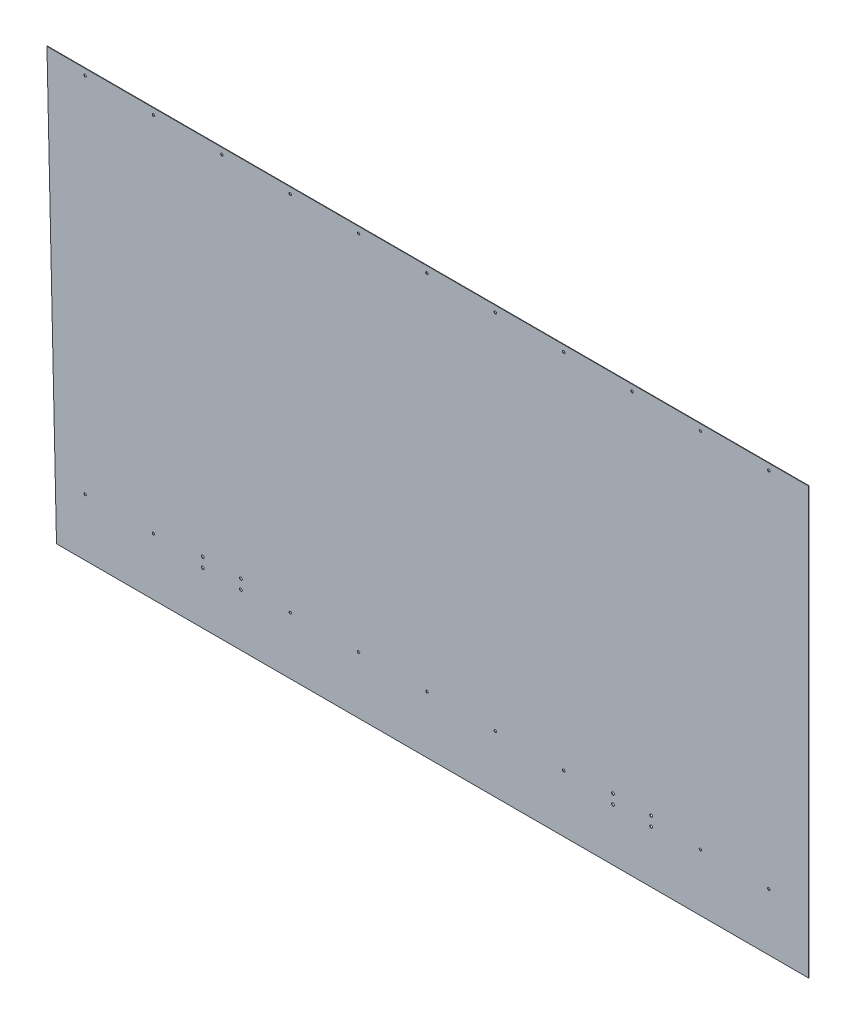
from build123d import *

# Parameters (mm, degrees)
SKETCH1_R      = 2.3876
SKETCH1_R_2    = 2.7813
SKETCH1_R_3    = 2.4257
EXTRUDE1_DEPTH = 1.016


with BuildPart() as part:
    # Sketch1 → Extrude1 (new body)
    with BuildSketch(Plane.XY):
        Polygon((0, 0), (1501.775, 0), (1501.775, 850.9), (-19.05, 850.9), align=None)
        with Locations((57.15, 114.3)):
            Circle(SKETCH1_R, mode=Mode.SUBTRACT)
        with Locations((292.1, 104.775)):
            Circle(SKETCH1_R_2, mode=Mode.SUBTRACT)
        with Locations((292.1, 123.825)):
            Circle(SKETCH1_R_2, mode=Mode.SUBTRACT)
        with Locations((193.675, 114.3)):
            Circle(SKETCH1_R, mode=Mode.SUBTRACT)
        with Locations((466.725, 114.3)):
            Circle(SKETCH1_R, mode=Mode.SUBTRACT)
        with Locations((603.25, 114.3)):
            Circle(SKETCH1_R, mode=Mode.SUBTRACT)
        with Locations((739.775, 114.3)):
            Circle(SKETCH1_R, mode=Mode.SUBTRACT)
        with Locations((1111.25, 123.825)):
            Circle(SKETCH1_R_2, mode=Mode.SUBTRACT)
        with Locations((1111.25, 104.775)):
            Circle(SKETCH1_R_2, mode=Mode.SUBTRACT)
        with Locations((1422.4, 114.3)):
            Circle(SKETCH1_R, mode=Mode.SUBTRACT)
        with Locations((368.3, 104.775)):
            Circle(SKETCH1_R_2, mode=Mode.SUBTRACT)
        with Locations((368.3, 123.825)):
            Circle(SKETCH1_R_2, mode=Mode.SUBTRACT)
        with Locations((876.3, 114.3)):
            Circle(SKETCH1_R, mode=Mode.SUBTRACT)
        with Locations((1285.875, 114.3)):
            Circle(SKETCH1_R, mode=Mode.SUBTRACT)
        with Locations((1187.45, 123.825)):
            Circle(SKETCH1_R_2, mode=Mode.SUBTRACT)
        with Locations((1187.45, 104.775)):
            Circle(SKETCH1_R_2, mode=Mode.SUBTRACT)
        with Locations((1012.825, 114.3)):
            Circle(SKETCH1_R, mode=Mode.SUBTRACT)
        with Locations((57.15, 838.2)):
            Circle(SKETCH1_R_3, mode=Mode.SUBTRACT)
        with Locations((193.675, 838.2)):
            Circle(SKETCH1_R_3, mode=Mode.SUBTRACT)
        with Locations((330.2, 838.2)):
            Circle(SKETCH1_R_3, mode=Mode.SUBTRACT)
        with Locations((466.725, 838.2)):
            Circle(SKETCH1_R_3, mode=Mode.SUBTRACT)
        with Locations((603.25, 838.2)):
            Circle(SKETCH1_R_3, mode=Mode.SUBTRACT)
        with Locations((739.775, 838.2)):
            Circle(SKETCH1_R_3, mode=Mode.SUBTRACT)
        with Locations((876.3, 838.2)):
            Circle(SKETCH1_R_3, mode=Mode.SUBTRACT)
        with Locations((1012.825, 838.2)):
            Circle(SKETCH1_R_3, mode=Mode.SUBTRACT)
        with Locations((1149.35, 838.2)):
            Circle(SKETCH1_R_3, mode=Mode.SUBTRACT)
        with Locations((1285.875, 838.2)):
            Circle(SKETCH1_R_3, mode=Mode.SUBTRACT)
        with Locations((1422.4, 838.2)):
            Circle(SKETCH1_R_3, mode=Mode.SUBTRACT)
    extrude(amount=-EXTRUDE1_DEPTH)


solid = part.part
